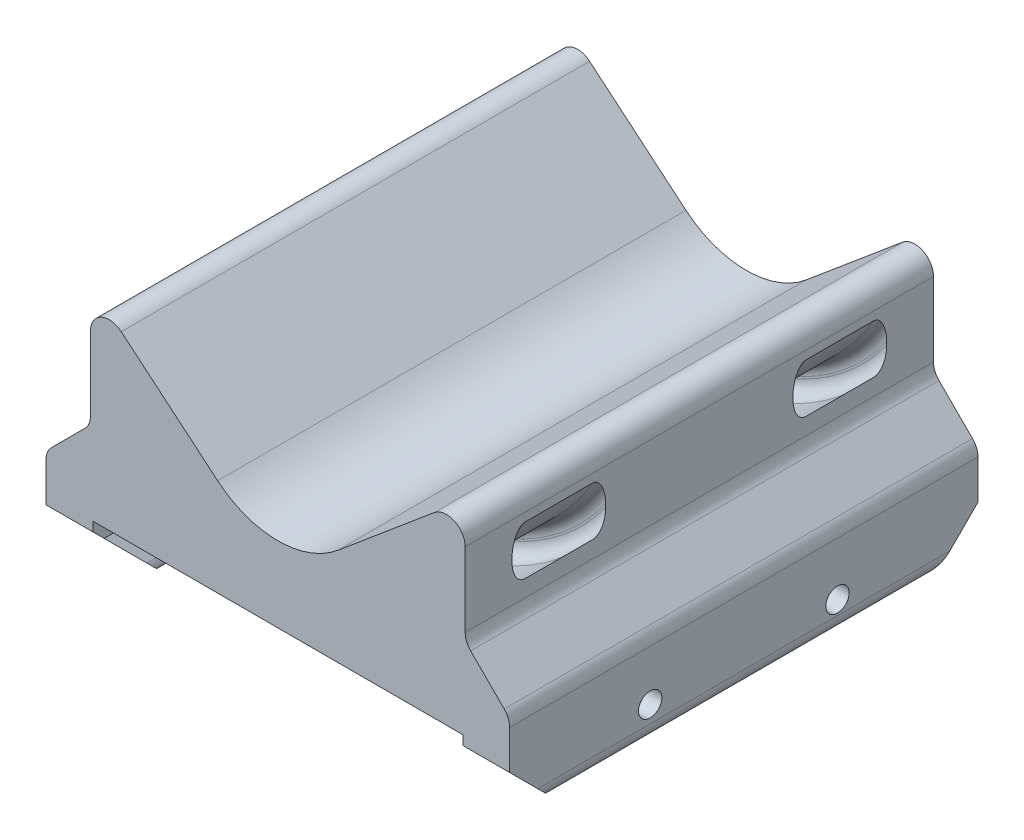
from build123d import *

# Parameters (mm, degrees)
BOSS_EXTRUDE1_DEPTH             = 50
SKETCH2_W                       = 10
SKETCH2_H                       = 3
M3X0_5_TAPPED_HOLE1_D           = 2.5
M3X0_5_TAPPED_HOLE1_CSINK_D     = 3.05
M3X0_5_TAPPED_HOLE1_CSINK_ANGLE = 90
FILLET2_R                       = 1.4
SKETCH5_W                       = 42.664543816
SKETCH5_H                       = 6
BOSS_EXTRUDE2_DEPTH             = 5
CUT_EXTRUDE1_DEPTH              = 70.875165408
CUT_EXTRUDE1_DEPTH_BACK         = 70.875165408


with BuildPart() as part:
    # Sketch1 → Boss-Extrude1 (new body)
    with BuildSketch(Plane.XY):
        with BuildLine():
            Line((6.427876097, 10.393628462), (16.714424781, 19.025067669))
            ThreePointArc((16.714424781, 19.025067669), (18.845236523, 19.305594357), (20, 17.492978783))
            Line((20, 17.492978783), (20, 9.578427125))
            ThreePointArc((20, 9.578427125), (20.152240935, 8.81306026), (20.585786438, 8.164213562))
            Line((20.585786438, 8.164213562), (24.164213562, 4.585786438))
            ThreePointArc((24.164213562, 4.585786438), (24.597759065, 3.93693974), (24.75, 3.171572875))
            Line((24.75, 3.171572875), (24.75, -4))
            ThreePointArc((24.75, -4), (24.164213562, -5.414213562), (22.75, -6))
            Line((22.75, -6), (18.277026938, -6))
            ThreePointArc((18.277026938, -6), (17.551980708, -5.538094609), (17.664191383, -4.685769912))
            Line((17.664191383, -4.685769912), (19.75, -2.2))
            Line((19.75, -2.2), (19.75, 0))
            Line((19.75, 0), (-19.75, 0))
            Line((-19.75, 0), (-19.75, -2.2))
            Line((-19.75, -2.2), (-17.664191383, -4.685769912))
            ThreePointArc((-17.664191383, -4.685769912), (-17.551980708, -5.538094609), (-18.277026938, -6))
            Line((-18.277026938, -6), (-22.75, -6))
            ThreePointArc((-22.75, -6), (-24.164213562, -5.414213562), (-24.75, -4))
            Line((-24.75, -4), (-24.75, 3.171572875))
            ThreePointArc((-24.75, 3.171572875), (-24.597759065, 3.93693974), (-24.164213562, 4.585786438))
            Line((-24.164213562, 4.585786438), (-20.585786438, 8.164213562))
            ThreePointArc((-20.585786438, 8.164213562), (-20.152240935, 8.81306026), (-20, 9.578427125))
            Line((-20, 9.578427125), (-20, 17.492978783))
            ThreePointArc((-20, 17.492978783), (-18.845236523, 19.305594357), (-16.714424781, 19.025067669))
            Line((-16.714424781, 19.025067669), (-6.427876097, 10.393628462))
            ThreePointArc((-6.427876097, 10.393628462), (0, 8.054072893), (6.427876097, 10.393628462))
        make_face()
    extrude(amount=BOSS_EXTRUDE1_DEPTH)

    # Sketch2 → Cut-Revolve1 (revolve, cut)
    with BuildSketch(Plane(origin=(0, 0, 0), x_dir=(0, 0, -1), z_dir=(1, 0, 0))):
        with Locations((-10, 3.5)):
            Rectangle(SKETCH2_W, SKETCH2_H)
        with Locations((-40, 3.5)):
            Rectangle(SKETCH2_W, SKETCH2_H)
    revolve(axis=Axis((0, 28.054072893, 39.353848425), (0, 0, -1)), mode=Mode.SUBTRACT)

    # M3x0.5 Tapped Hole1 (through all)
    with Locations(Plane.ZY.offset(24.75)):
        with Locations((15, -2.5), (34.997686823, -2.195826159)):
            CounterSinkHole(M3X0_5_TAPPED_HOLE1_D / 2, M3X0_5_TAPPED_HOLE1_CSINK_D / 2, counter_sink_angle=M3X0_5_TAPPED_HOLE1_CSINK_ANGLE)

    # Fillet2
    fillet2_edges = [part.edges().sort_by_distance(p)[0] for p in [
        (0, 5, 5),
        (0, 2, 5),
        (0, 2, 15),
        (0, 5, 15),
        (0, 5, 35),
        (0, 2, 35),
        (0, 2, 45),
        (0, 5, 45),
    ]]
    fillet(fillet2_edges, radius=FILLET2_R)

    # Sketch5 → Boss-Extrude2 (add)
    with BuildSketch(Plane(origin=(0, 0, 0), x_dir=(-1, 0, 0), z_dir=(0, 0, -1))):
        with Locations((-0.389940088, -3)):
            Rectangle(SKETCH5_W, SKETCH5_H)
    extrude(amount=-BOSS_EXTRUDE2_DEPTH)

    # Sketch6 → Cut-Extrude1 (cut, two sides: drawn at the far end of the back side and taken through both)
    with BuildSketch(Plane(origin=(20, 0, 0), x_dir=(0, 0, -1), z_dir=(1, 0, 0)).offset(-CUT_EXTRUDE1_DEPTH_BACK)):
        Polygon((-50, 32.923814778), (-50, -1), (-45, -6), (-5, -6), (0, -1), (0, 27.637517517), (9.715724937, 27.637517517), (9.715724937, -14.512697257), (-61.049340823, -14.512697257), (-61.049340823, 32.923814778), align=None)
    extrude(amount=CUT_EXTRUDE1_DEPTH + CUT_EXTRUDE1_DEPTH_BACK, mode=Mode.SUBTRACT)


solid = part.part
